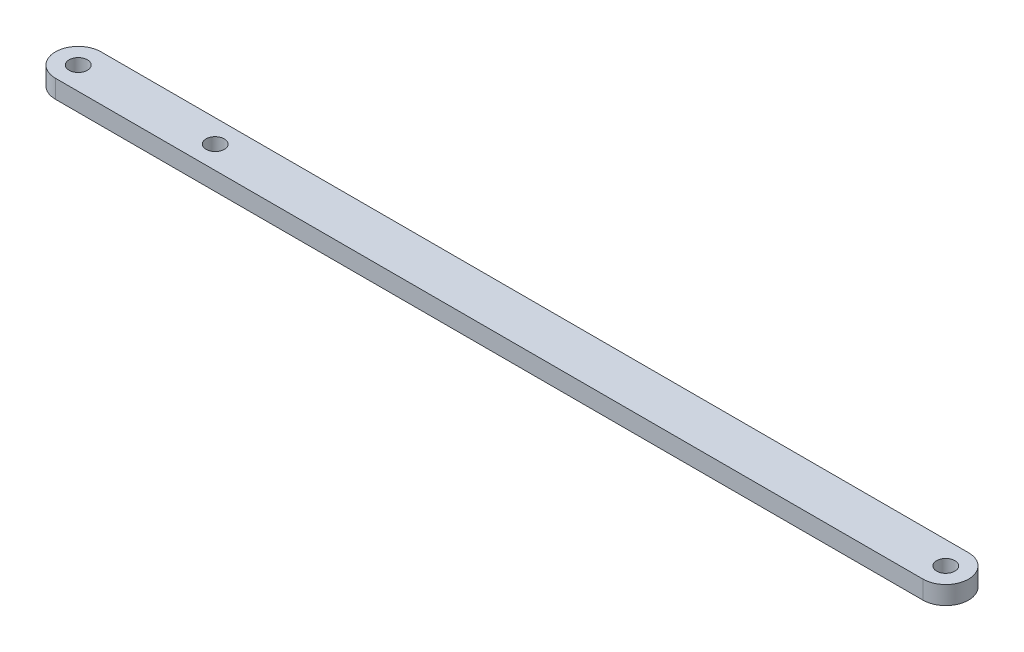
from build123d import *

# Parameters (mm, degrees)
SKETCH1_R           = 1
BOSS_EXTRUDE1_DEPTH = 2


with BuildPart() as part:
    # Sketch1 → Boss-Extrude1 (new body)
    with BuildSketch(Plane(origin=(0, 0, 0), x_dir=(1, 0, 0), z_dir=(0, 1, 0))):
        with BuildLine():
            Line((-10, 2.5), (85, 2.5))
            ThreePointArc((85, 2.5), (87.5, 0), (85, -2.5))
            Line((85, -2.5), (-10, -2.5))
            ThreePointArc((-10, -2.5), (-12.5, 0), (-10, 2.5))
        make_face()
        with Locations(Location((85, 0, 0), (0, 0, 270))):
            Circle(SKETCH1_R, mode=Mode.SUBTRACT)
        with Locations(Location((-10, 0, 0), (0, 0, 270))):
            Circle(SKETCH1_R, mode=Mode.SUBTRACT)
        with Locations(Location((5, 0, 0), (0, 0, 270))):
            Circle(SKETCH1_R, mode=Mode.SUBTRACT)
    extrude(amount=BOSS_EXTRUDE1_DEPTH)


solid = part.part
